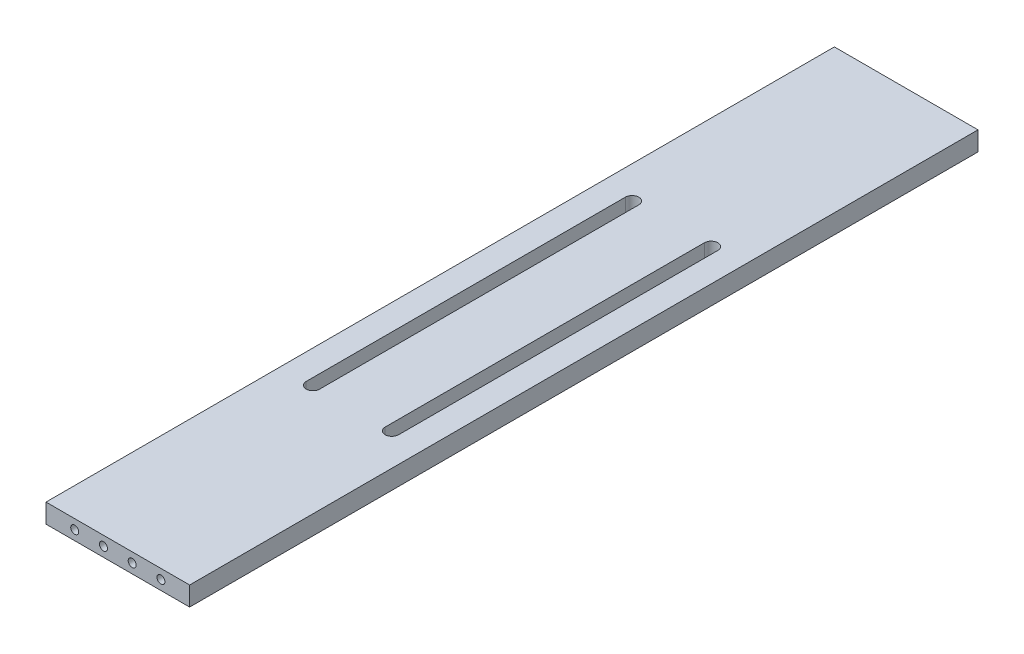
from build123d import *

# Parameters (mm, degrees)
SKETCH_1_W          = 45
SKETCH_1_H          = 247
EXTRUDE_1_DEPTH     = 6
CUT_EXTRUDE_1_DEPTH = 249.095243808
M3X0_51_D           = 2.5
M3X0_51_DEPTH       = 8.5
M3X0_51_TIP         = 0.751075774
M3X0_52_D           = 2.5
M3X0_52_DEPTH       = 8.5
M3X0_52_TIP         = 0.751075774


with BuildPart() as part:
    # Эскиз1 → Бобышка-Вытянуть1 (new body)
    with BuildSketch(Plane(origin=(0, 0, 0), x_dir=(1, 0, 0), z_dir=(0, 1, 0))):
        with Locations((0, -123.5)):
            Rectangle(SKETCH_1_W, SKETCH_1_H)
    extrude(amount=EXTRUDE_1_DEPTH)

    # Эскиз2 → Вырез-Вытянуть1 (cut, through all)
    with BuildSketch(Plane(origin=(0, 6, 0), x_dir=(1, 0, 0), z_dir=(0, 1, 0))):
        with BuildLine():
            Line((-10.274368671, -73.5), (-10.274368671, -173.5))
            ThreePointArc((-10.274368671, -173.5), (-12.374368671, -175.6), (-14.474368671, -173.5))
            Line((-14.474368671, -173.5), (-14.474368671, -73.5))
            ThreePointArc((-14.474368671, -73.5), (-12.374368671, -71.4), (-10.274368671, -73.5))
        make_face()
        with BuildLine():
            Line((10.274368671, -73.5), (10.274368671, -173.5))
            ThreePointArc((10.274368671, -173.5), (12.374368671, -175.6), (14.474368671, -173.5))
            Line((14.474368671, -173.5), (14.474368671, -73.5))
            ThreePointArc((14.474368671, -73.5), (12.374368671, -71.4), (10.274368671, -73.5))
        make_face()
    extrude(amount=-CUT_EXTRUDE_1_DEPTH, mode=Mode.SUBTRACT)

    # Отверстие обработанное метчиком M3x0.51
    with Locations(Plane.XY.offset(247)):
        with Locations((-13.5, 3), (-4.5, 3), (4.5, 3), (13.5, 3)):
            Hole(M3X0_51_D / 2, depth=M3X0_51_DEPTH)
            with Locations((0, 0, -(M3X0_51_DEPTH + M3X0_51_TIP / 2))):  # 118° drill point
                Cone(0, M3X0_51_D / 2, M3X0_51_TIP, mode=Mode.SUBTRACT)

    # Отверстие обработанное метчиком M3x0.52
    with Locations(Plane(origin=(0, 0, 0), x_dir=(-1, 0, 0), z_dir=(0, 0, -1))):
        with Locations((-13.5, 3), (-4.5, 3), (4.5, 3), (13.5, 3)):
            Hole(M3X0_52_D / 2, depth=M3X0_52_DEPTH)
            with Locations((0, 0, -(M3X0_52_DEPTH + M3X0_52_TIP / 2))):  # 118° drill point
                Cone(0, M3X0_52_D / 2, M3X0_52_TIP, mode=Mode.SUBTRACT)


solid = part.part
